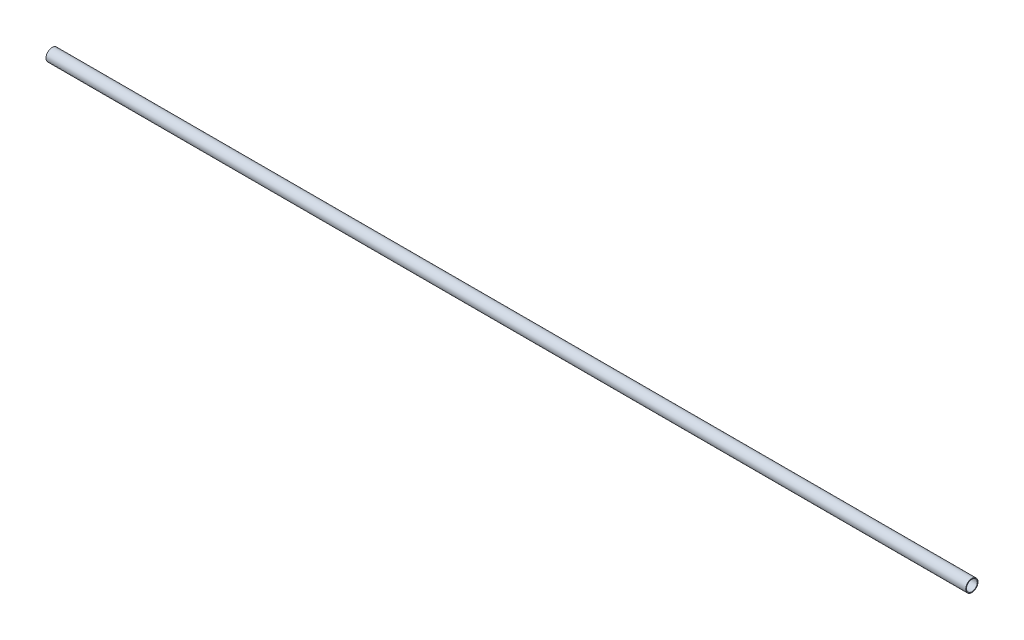
from build123d import *

# Parameters (mm, degrees)
SKETCH1_R           = 12.5
SKETCH1_R_2         = 11
BOSS_EXTRUDE1_DEPTH = 1872


with BuildPart() as part:
    # Sketch1 → Boss-Extrude1 (new body)
    with BuildSketch(Plane(origin=(0, 0, 0), x_dir=(0, 0, -1), z_dir=(1, 0, 0))):
        Circle(SKETCH1_R)
        Circle(SKETCH1_R_2, mode=Mode.SUBTRACT)
    extrude(amount=BOSS_EXTRUDE1_DEPTH)


solid = part.part
